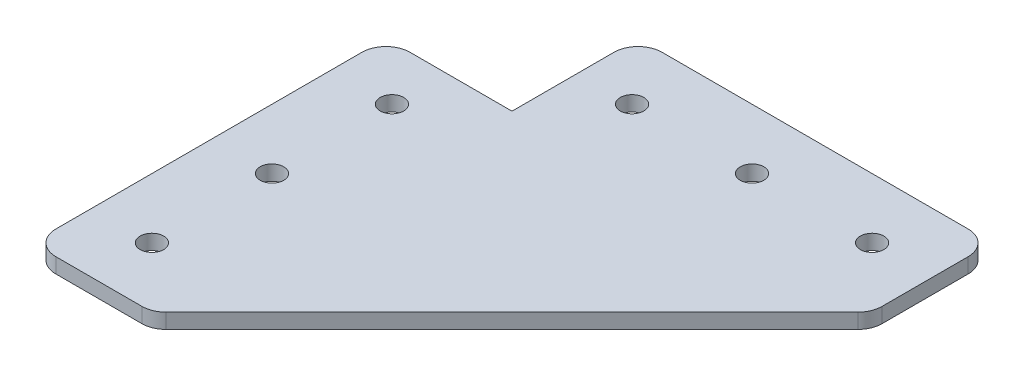
from build123d import *

# Parameters (mm, degrees)
BOSS_EXTRUDE1_DEPTH = 3.175
SKETCH2_R           = 2.4892
CUT_EXTRUDE1_DEPTH  = 144.719172782
SKETCH3_W           = 26.67
SKETCH3_H           = 26.67
CUT_EXTRUDE2_DEPTH  = 144.719172782
FILLET1_R           = 5.08


with BuildPart() as part:
    # Sketch1 → Boss-Extrude1 (new body)
    with BuildSketch(Plane(origin=(0, 0, 0), x_dir=(1, 0, 0), z_dir=(0, 1, 0))):
        Polygon((0, 0), (0, 101.6), (101.6, 101.6), (101.6, 76.2), (25.4, 0), align=None)
    extrude(amount=BOSS_EXTRUDE1_DEPTH)

    # Sketch2 → Cut-Extrude1 (cut, through all)
    with BuildSketch(Plane(origin=(0, 3.175, 0), x_dir=(1, 0, 0), z_dir=(0, 1, 0))):
        with Locations(Location((12.7, 88.9, 0), (0, 0, 270))):
            Circle(SKETCH2_R)
        with Locations(Location((38.1, 88.9, 0), (0, 0, 270))):
            Circle(SKETCH2_R)
        with Locations(Location((63.5, 88.9, 0), (0, 0, 270))):
            Circle(SKETCH2_R)
        with Locations(Location((88.9, 88.9, 0), (0, 0, 270))):
            Circle(SKETCH2_R)
        with Locations(Location((12.7, 63.5, 0), (0, 0, 270))):
            Circle(SKETCH2_R)
        with Locations(Location((12.7, 38.1, 0), (0, 0, 270))):
            Circle(SKETCH2_R)
        with Locations(Location((12.7, 12.7, 0), (0, 0, 270))):
            Circle(SKETCH2_R)
    extrude(amount=-CUT_EXTRUDE1_DEPTH, mode=Mode.SUBTRACT)

    # Sketch3 → Cut-Extrude2 (cut, through all)
    with BuildSketch(Plane(origin=(0, 3.175, 0), x_dir=(1, 0, 0), z_dir=(0, 1, 0))):
        with Locations((13.335, 88.265)):
            Rectangle(SKETCH3_W, SKETCH3_H)
    extrude(amount=-CUT_EXTRUDE2_DEPTH, mode=Mode.SUBTRACT)

    # Fillet1
    fillet1_edges = [part.edges().sort_by_distance(p)[0] for p in [
        (0, 1.5875, -74.93),
        (26.67, 1.5875, -101.6),
        (0, 1.5875, 0),
        (101.6, 1.5875, -101.6),
        (101.6, 1.5875, -76.2),
        (25.4, 1.5875, 0),
    ]]
    fillet(fillet1_edges, radius=FILLET1_R)


solid = part.part
